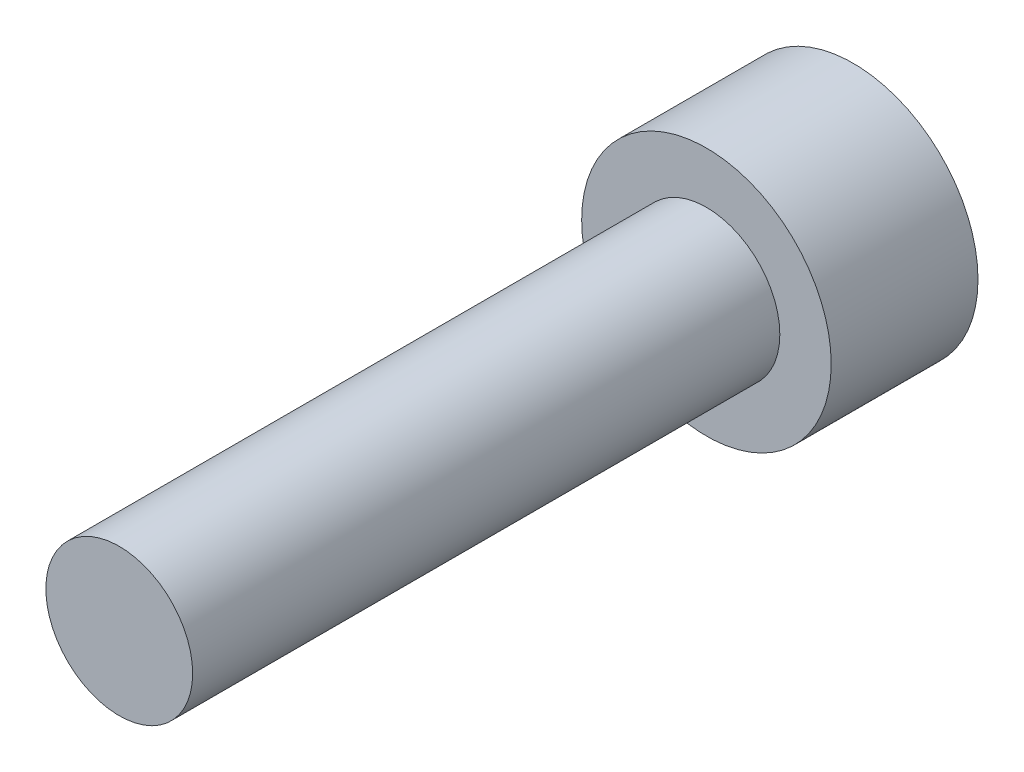
from build123d import *

# Parameters (mm, degrees)
HEAD_ENVELOPE_START         = -5
SKETCH1_R                   = 4.25
HEAD_ENVELOPE_DEPTH         = 5
SKETCH2_R                   = 2.5
THREAD_MAJOR_ENVELOPE_DEPTH = 20


with BuildPart() as part:
    # Sketch1 → Head_Envelope (new body)
    with BuildSketch(Plane.XY.offset(HEAD_ENVELOPE_START)):
        Circle(SKETCH1_R)
    extrude(amount=HEAD_ENVELOPE_DEPTH)

    # Sketch2 → Thread_Major_Envelope (add)
    with BuildSketch(Plane.XY):
        Circle(SKETCH2_R)
    extrude(amount=THREAD_MAJOR_ENVELOPE_DEPTH)


solid = part.part
